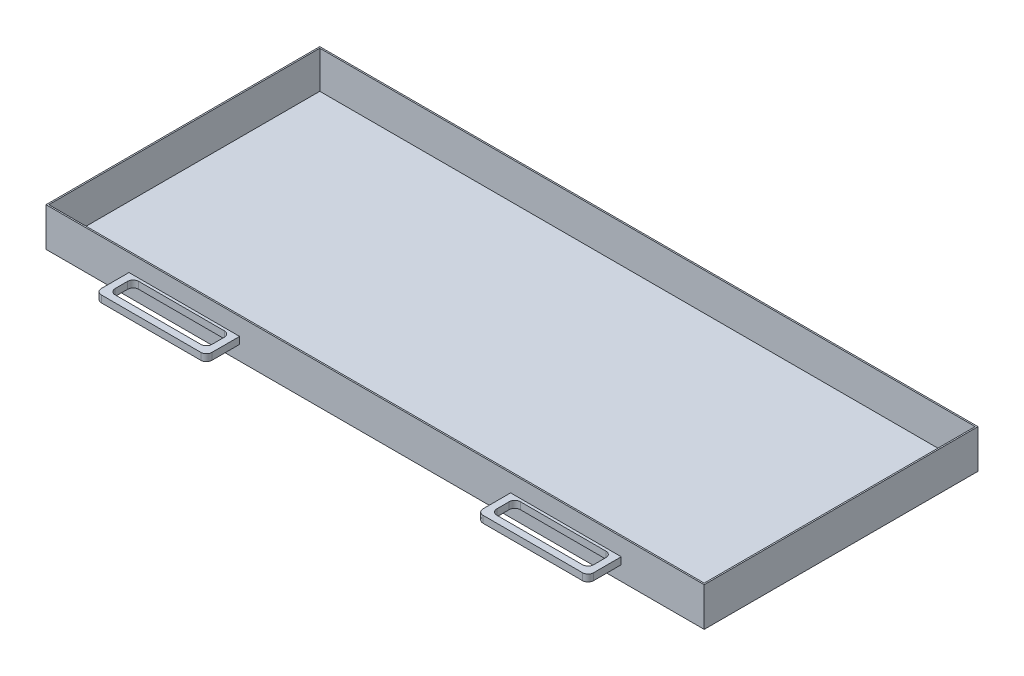
from build123d import *

# Parameters (mm, degrees)
SKETCH1_W           = 604.52
SKETCH1_H           = 251.46
BOSS_EXTRUDE1_DEPTH = 35.56
SKETCH2_W           = 601.98
SKETCH2_H           = 248.92
CUT_EXTRUDE1_DEPTH  = 34.29
SKETCH3_W           = 101.6
SKETCH3_H           = 6.35
BOSS_EXTRUDE2_DEPTH = 30.48
SKETCH4_W           = 88.9
SKETCH4_H           = 21.59
CUT_EXTRUDE2_DEPTH  = 341.808114523
FILLET1_R           = 5.08
FILLET2_R           = 5.08


with BuildPart() as part:
    # Sketch1 → Boss-Extrude1 (new body)
    with BuildSketch(Plane(origin=(0, 0, 0), x_dir=(1, 0, 0), z_dir=(0, 1, 0))):
        Rectangle(SKETCH1_W, SKETCH1_H)
    extrude(amount=-BOSS_EXTRUDE1_DEPTH)

    # Sketch2 → Cut-Extrude1 (cut)
    with BuildSketch(Plane(origin=(0, 0, 0), x_dir=(1, 0, 0), z_dir=(0, 1, 0))):
        Rectangle(SKETCH2_W, SKETCH2_H)
    extrude(amount=-CUT_EXTRUDE1_DEPTH, mode=Mode.SUBTRACT)

    # Sketch3 → Boss-Extrude2 (add)
    with BuildSketch(Plane.XY.offset(125.73)):
        with Locations((-175.26, -19.05)):
            Rectangle(SKETCH3_W, SKETCH3_H)
        with Locations((175.26, -19.05)):
            Rectangle(SKETCH3_W, SKETCH3_H)
    extrude(amount=BOSS_EXTRUDE2_DEPTH)

    # Sketch4 → Cut-Extrude2 (cut, through all)
    with BuildSketch(Plane(origin=(0, -15.875, 0), x_dir=(1, 0, 0), z_dir=(0, 1, 0))):
        with Locations((-175.26, -139.065)):
            Rectangle(SKETCH4_W, SKETCH4_H)
        with Locations((175.26, -139.065)):
            Rectangle(SKETCH4_W, SKETCH4_H)
    extrude(amount=-CUT_EXTRUDE2_DEPTH, mode=Mode.SUBTRACT)

    # Fillet1
    fillet1_edges = [part.edges().sort_by_distance(p)[0] for p in [
        (-219.71, -19.05, 149.86),
        (-219.71, -19.05, 128.27),
        (-130.81, -19.05, 128.27),
        (-130.81, -19.05, 149.86),
        (219.71, -19.05, 128.27),
        (219.71, -19.05, 149.86),
        (130.81, -19.05, 149.86),
        (130.81, -19.05, 128.27),
    ]]
    fillet(fillet1_edges, radius=FILLET1_R)

    # Fillet2
    fillet2_edges = [part.edges().sort_by_distance(p)[0] for p in [
        (-226.06, -19.05, 156.21),
        (-124.46, -19.05, 156.21),
        (226.06, -19.05, 156.21),
        (124.46, -19.05, 156.21),
    ]]
    fillet(fillet2_edges, radius=FILLET2_R)


solid = part.part
